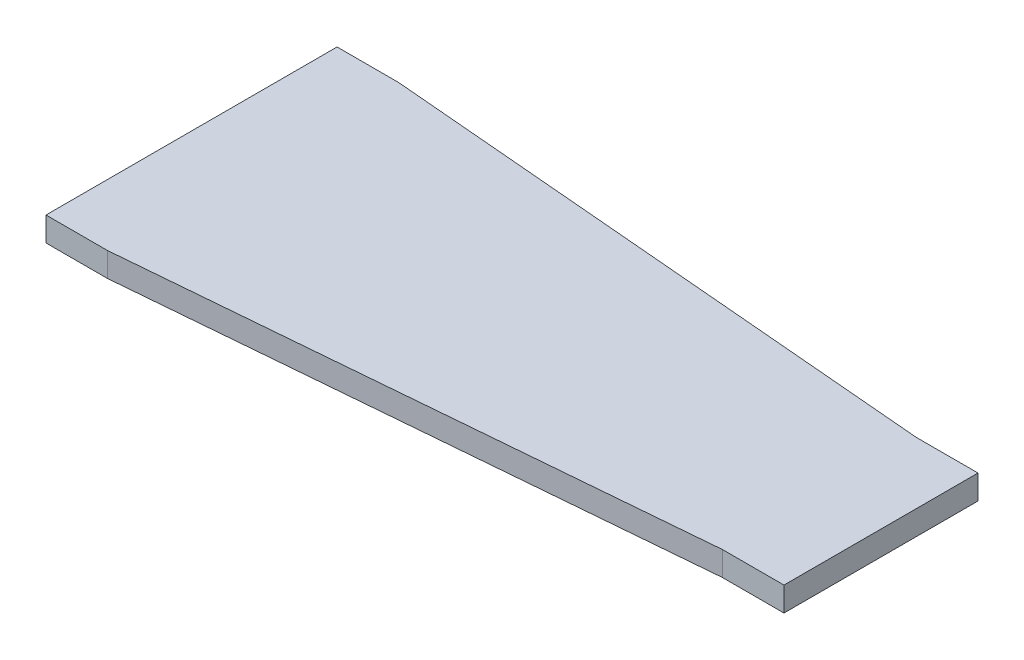
from build123d import *

# Parameters (mm, degrees)
BOSS_EXTRUDE1_DEPTH = 10


with BuildPart() as part:
    # Sketch1 → Boss-Extrude1 (new body)
    with BuildSketch(Plane(origin=(0, 0, 0), x_dir=(1, 0, 0), z_dir=(0, 1, 0))):
        Polygon((233.45, 40), (258.85, 40), (258.85, -40), (233.45, -40), (0, -60), (-25.4, -60), (-25.4, 60), (0, 60), align=None)
    extrude(amount=BOSS_EXTRUDE1_DEPTH)


solid = part.part
